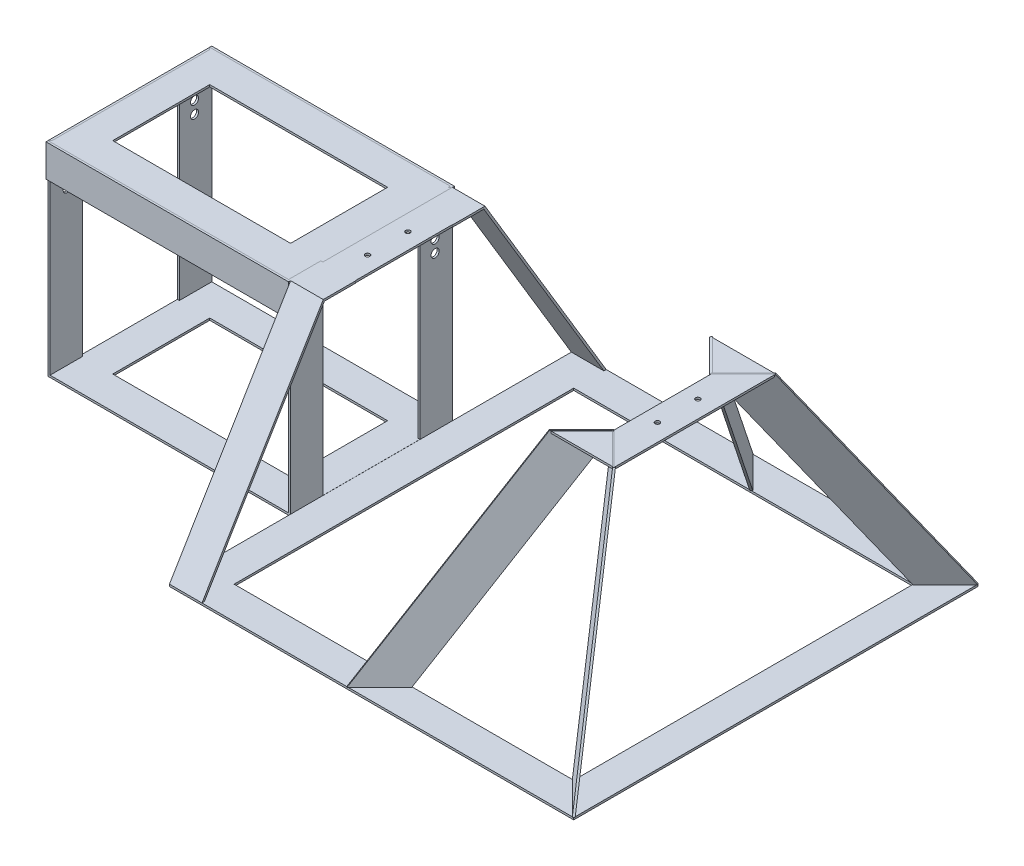
from build123d import *

# Parameters (mm, degrees)
SKETCH1_W                = 1000
SKETCH1_H                = 1000
SKETCH1_W_2              = 840
SKETCH1_H_2              = 840
BOSS_EXTRUDE1_DEPTH      = 2.5
BOSS_EXTRUDE2_START      = 500
SKETCH2_W                = 800
SKETCH2_H                = 400
SKETCH2_W_2              = 640
SKETCH2_H_2              = 240
BOSS_EXTRUDE2_DEPTH      = 2.5
BOSS_EXTRUDE3_DEPTH      = 2.5
BOSS_EXTRUDE4_DEPTH      = 5
CUT_EXTRUDE1_START       = 500
SKETCH7_W                = 637.601368613
SKETCH7_H                = 400
CUT_EXTRUDE1_DEPTH       = 2.5
BOSS_EXTRUDE5_DEPTH      = 502.5
BOSS_EXTRUDE5_DEPTH_BACK = 2.5
SKETCH8_W                = 600
SKETCH8_H                = 400
SKETCH8_W_2              = 440
SKETCH8_H_2              = 240
SKETCH9_W                = 400.781427926
SKETCH9_H                = 495
CUT_EXTRUDE5_DEPTH       = 600
SKETCH15_W               = 5.000134222
SKETCH15_H               = 80
BOSS_EXTRUDE8_DEPTH      = 500
MIRROR4_COPY_1_SKETCH_W  = 5.000134222
MIRROR4_COPY_1_SKETCH_H  = 80
MIRROR4_COPY_1_DEPTH     = 500
SKETCH16_R               = 10
CUT_EXTRUDE6_DEPTH       = 611
BOSS_EXTRUDE9_START      = 200
BOSS_EXTRUDE9_DEPTH      = 5
SKETCH18_W               = 5.000134222
SKETCH18_H               = 79.998199755
BOSS_EXTRUDE10_DEPTH     = 240
SKETCH19_R               = 5.75
CUT_EXTRUDE7_DEPTH       = 5
BOSS_EXTRUDE11_REACH     = 1499.585
SKETCH20_W               = 74.818874407
SKETCH20_H               = 5
MIRROR9_COPY_1_DEPTH     = 2.5
MIRROR9_COPY_2_DEPTH     = 2.5
BOSS_EXTRUDE12_REACH     = 1499.585
SKETCH21_W               = 74.818874407
SKETCH21_H               = 5


with BuildPart() as part:
    # Sketch1 → Boss-Extrude1 (new, symmetric)
    with BuildSketch(Plane(origin=(0, 0, 0), x_dir=(1, 0, 0), z_dir=(0, 1, 0))):
        Rectangle(SKETCH1_W, SKETCH1_H)
        Rectangle(SKETCH1_W_2, SKETCH1_H_2, mode=Mode.SUBTRACT)
    extrude(amount=BOSS_EXTRUDE1_DEPTH, both=True)



with BuildPart() as body_2:
    # Sketch2 → Boss-Extrude2 (new, symmetric)
    with BuildSketch(Plane(origin=(0, 0, 0), x_dir=(1, 0, 0), z_dir=(0, 1, 0)).offset(BOSS_EXTRUDE2_START)):
        with Locations((-100.280499743, 0)):
            Rectangle(SKETCH2_W, SKETCH2_H)
        with Locations((-100.280499743, 0)):
            Rectangle(SKETCH2_W_2, SKETCH2_H_2, mode=Mode.SUBTRACT)
    extrude(amount=BOSS_EXTRUDE2_DEPTH, both=True)


with BuildPart() as part_1:
    add(part.part)

    add(body_2.part)  # Boss-Extrude3 merges body 2
    # Sketch5 → Boss-Extrude3 (add, symmetric)
    with BuildSketch(Plane(origin=(-0.24443739, 0.048750349, 0.24443739), x_dir=(0.7139678352410923, 0.1369458836422083, 0.6866554850830242), z_dir=(-0.7001784988423656, 0.13964289999030452, 0.7001784988423663))):
        Polygon((308.086620699, 469.324430499), (420.136486325, 453.67746232), (700.654024871, -95.341835287), (588.604159245, -79.694867108), align=None)
    boss_extrude3 = extrude(amount=BOSS_EXTRUDE3_DEPTH, both=True)

    # Mirror1: Boss-Extrude3 across plane
    add(boss_extrude3.mirror(Plane.XY))

    # Sketch6 → Boss-Extrude4 (add)
    with BuildSketch(Plane(origin=(0, 221.25, 368.75), x_dir=(1, 0, 0), z_dir=(0, 0.5144957554275265, 0.8574929257125443))):
        Polygon((-500.280499743, 327.991044085), (-419.492475854, 327.991044085), (-419.492475854, -255.104145399), (-500, -255.104145399), align=None)
    boss_extrude4 = extrude(amount=-BOSS_EXTRUDE4_DEPTH)

    # Mirror2: Boss-Extrude4 across plane
    add(boss_extrude4.mirror(Plane.XY))

    # Sketch7 → Cut-Extrude1 (cut, symmetric)
    with BuildSketch(Plane(origin=(0, 0, 0), x_dir=(1, 0, 0), z_dir=(0, 1, 0)).offset(CUT_EXTRUDE1_START)):
        with Locations((-100.691791548, 0)):
            Rectangle(SKETCH7_W, SKETCH7_H)
    extrude(amount=CUT_EXTRUDE1_DEPTH, both=True, mode=Mode.SUBTRACT)



with BuildPart() as body_2_2:
    # Sketch8 → Boss-Extrude5 (new, two sides: drawn at the far end of the back side and taken through both)
    with BuildSketch(Plane(origin=(0, 0, 0), x_dir=(1, 0, 0), z_dir=(0, 1, 0)).offset(-BOSS_EXTRUDE5_DEPTH_BACK)):
        with Locations((-800.280499743, 0)):
            Rectangle(SKETCH8_W, SKETCH8_H)
        with Locations((-800.280499743, 0)):
            Rectangle(SKETCH8_W_2, SKETCH8_H_2, mode=Mode.SUBTRACT)
    extrude(amount=BOSS_EXTRUDE5_DEPTH + BOSS_EXTRUDE5_DEPTH_BACK)

    # Sketch9 → Cut-Extrude5 (cut)
    with BuildSketch(Plane.ZY.offset(1100.280499743)):
        with Locations((-0.390713963, 250)):
            Rectangle(SKETCH9_W, SKETCH9_H)
    extrude(amount=-CUT_EXTRUDE5_DEPTH, mode=Mode.SUBTRACT)


with BuildPart() as cut_extrude5_piece_1:
    # of the separate pieces the step leaves, piece 1, a body of its own (cut_extrude5_pieces)
    add(body_2_2.part.solids().sort_by_distance((-1100.280499743, 497.5, -200))[0])


with BuildPart() as cut_extrude5_piece_2:
    # of the separate pieces the step leaves, piece 2, a body of its own (cut_extrude5_pieces)
    add(body_2_2.part.solids().sort_by_distance((-1100.280499743, -2.5, -200))[0])


with BuildPart() as part_2:
    add(part_1.part)

    add(cut_extrude5_piece_2.part)  # Boss-Extrude8 merges Cut-Extrude5 piece 2
    # Sketch15 → Boss-Extrude8 (add)
    with BuildSketch(Plane(origin=(0, 2.5, 0), x_dir=(1, 0, 0), z_dir=(0, 1, 0))):
        with Locations((-502.780566854, -160)):
            Rectangle(SKETCH15_W, SKETCH15_H)
    boss_extrude8 = extrude(amount=BOSS_EXTRUDE8_DEPTH)

    # Mirror3: Boss-Extrude8 across plane
    add(boss_extrude8.mirror(Plane.XY))

    # Mirror4: Boss-Extrude8 across plane
    add(boss_extrude8.mirror(Plane.ZY.offset(800.280499743)))

    # Mirror4 copy 1 sketch → Mirror4 copy 1 (add)
    with BuildSketch(Plane(origin=(-1600.560999486, 2.5, 0), x_dir=(-1, 0, 0), z_dir=(0, 1, 0))):
        with Locations((-502.780566854, -160)):
            Rectangle(MIRROR4_COPY_1_SKETCH_W, MIRROR4_COPY_1_SKETCH_H)
    extrude(amount=MIRROR4_COPY_1_DEPTH)

    # Sketch16 → Cut-Extrude6 (cut)
    with BuildSketch(Plane.ZY.offset(1100.280499743)):
        with Locations((157.5, 442.5)):
            Circle(SKETCH16_R)
        with Locations((157.5, 412.5)):
            Circle(SKETCH16_R)
        with Locations((157.5, 382.5)):
            Circle(SKETCH16_R)
        with Locations((-157.5, 442.5)):
            Circle(SKETCH16_R)
        with Locations((-157.5, 412.5)):
            Circle(SKETCH16_R)
        with Locations((-157.5, 382.5)):
            Circle(SKETCH16_R)
    extrude(amount=-CUT_EXTRUDE6_DEPTH, mode=Mode.SUBTRACT)

    # Sketch17 → Boss-Extrude9 (add)
    with BuildSketch(Plane.XY.offset(BOSS_EXTRUDE9_START)):
        Polygon((-1100.280499743, 502.5), (-500.280499743, 502.5), (-500.235619791, 422.500012589), (-1100.280499743, 422.500012589), align=None)
    boss_extrude9 = extrude(amount=BOSS_EXTRUDE9_DEPTH)

    # Mirror6: Boss-Extrude9 across plane
    add(boss_extrude9.mirror(Plane.XY))

    # Sketch18 → Boss-Extrude10 (add)
    with BuildSketch(Plane.XY.offset(-120)):
        with Locations((-1097.780432632, 462.500900123)):
            Rectangle(SKETCH18_W, SKETCH18_H)
    extrude(amount=BOSS_EXTRUDE10_DEPTH)

    # Sketch19 → Cut-Extrude7 (cut)
    with BuildSketch(Plane(origin=(0, 502.5, 0), x_dir=(1, 0, 0), z_dir=(0, 1, 0))):
        with Locations(Location((-460, 50, 0), (0, 0, 270))):
            Circle(SKETCH19_R)
        with Locations(Location((-460, -50, 0), (0, 0, 90))):
            Circle(SKETCH19_R)
        with Locations(Location((257.12893746, 50, 0), (0, 0, 270))):
            Circle(SKETCH19_R)
        with Locations(Location((257.12893746, -50, 0), (0, 0, 90))):
            Circle(SKETCH19_R)
    extrude(amount=-CUT_EXTRUDE7_DEPTH, mode=Mode.SUBTRACT)

    # Mirror8: Boss-Extrude3 across plane
    add(boss_extrude3.mirror(Plane.ZY.offset(-219.719500257)))

    # Sketch20 → Boss-Extrude11 (add, up to next)
    with BuildSketch(Plane.ZY.offset(-218.108892759), mode=Mode.PRIVATE) as boss_extrude11_sk1:
        with Locations((162.590562796, 500)):
            Rectangle(SKETCH20_W, SKETCH20_H)
    boss_extrude11_tool1 = extrude(boss_extrude11_sk1.sketch, amount=BOSS_EXTRUDE11_REACH, mode=Mode.PRIVATE) - part_2.part
    add(boss_extrude11_tool1.solids().sort_by_distance((218.108893, 500, 162.590563))[0])

    # Mirror9 copy 1 sketch → Mirror9 copy 1 (add, symmetric)
    with BuildSketch(Plane(origin=(439.683437904, 0.048750349, -0.24443739), x_dir=(-0.7139678352410916, 0.1369458836422083, -0.6866554850830249), z_dir=(0.7001784988423663, 0.13964289999030452, -0.7001784988423656))):
        Polygon((308.086620699, 469.324430499), (420.136486325, 453.67746232), (700.654024871, -95.341835287), (588.604159245, -79.694867108), align=None)
    extrude(amount=MIRROR9_COPY_1_DEPTH, both=True)

    # Mirror9 copy 2 sketch → Mirror9 copy 2 (add, symmetric)
    with BuildSketch(Plane(origin=(-0.24443739, 0.048750349, -0.24443739), x_dir=(0.7139678352410923, 0.1369458836422083, -0.6866554850830242), z_dir=(-0.7001784988423656, 0.13964289999030452, -0.7001784988423663))):
        Polygon((308.086620699, -469.324430499), (420.136486325, -453.67746232), (700.654024871, 95.341835287), (588.604159245, 79.694867108), align=None)
    extrude(amount=MIRROR9_COPY_2_DEPTH, both=True)

    # Sketch21 → Boss-Extrude12 (add, up to next)
    with BuildSketch(Plane.ZY.offset(-218.108892759), mode=Mode.PRIVATE) as boss_extrude12_sk1:
        with Locations((-162.590562796, 500)):
            Rectangle(SKETCH21_W, SKETCH21_H)
    boss_extrude12_tool1 = extrude(boss_extrude12_sk1.sketch, amount=BOSS_EXTRUDE12_REACH, mode=Mode.PRIVATE) - part_2.part
    add(boss_extrude12_tool1.solids().sort_by_distance((218.108893, 500, -162.590563))[0])


solid = Compound([cut_extrude5_piece_1.part, part_2.part])
